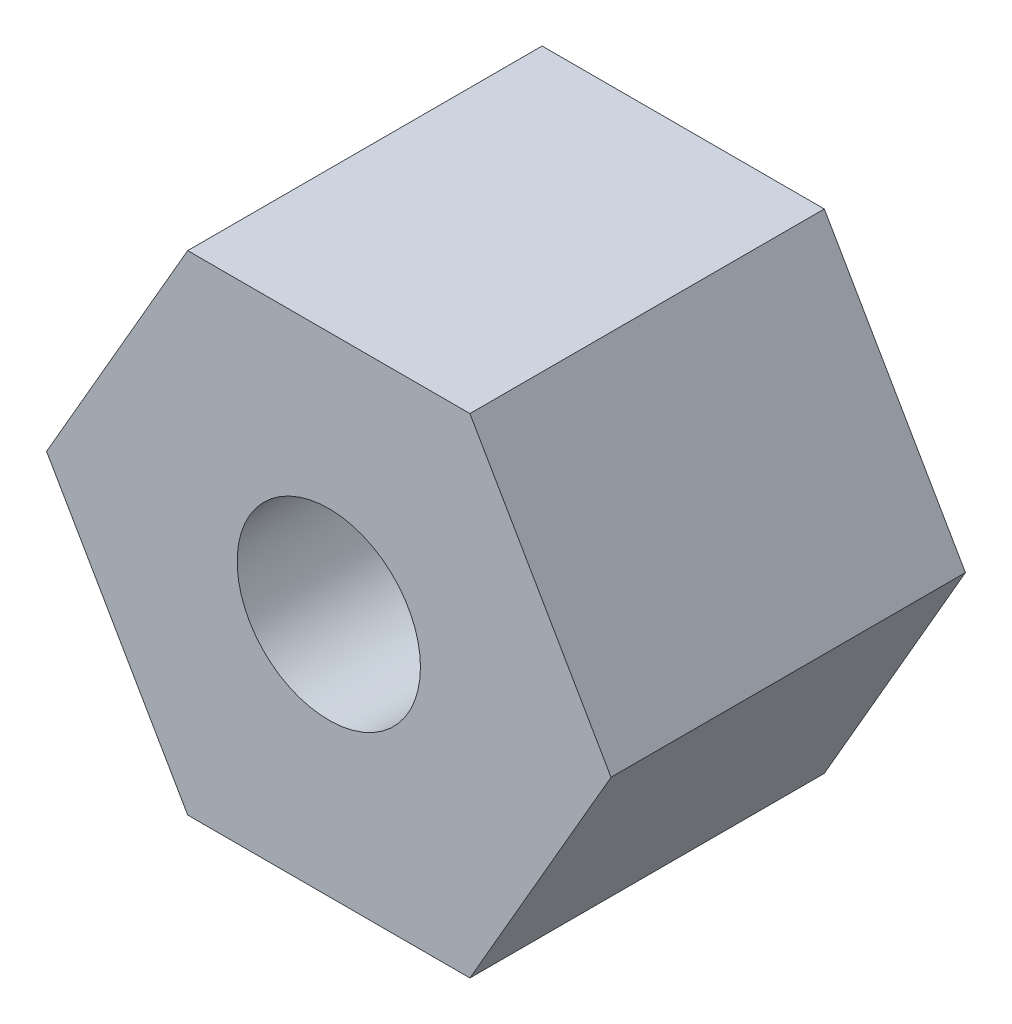
from build123d import *

# Parameters (mm, degrees)
SKETCH_1_R      = 1.5
EXTRUDE_1_DEPTH = 5.8


with BuildPart() as part:
    # 草图1 → 凸台-拉伸1 (new body)
    with BuildSketch(Plane.XY):
        Polygon((2.309401077, -4), (4.618802154, 0), (2.309401077, 4), (-2.309401077, 4), (-4.618802154, 0), (-2.309401077, -4), align=None)
        Circle(SKETCH_1_R, mode=Mode.SUBTRACT)
    extrude(amount=EXTRUDE_1_DEPTH)


solid = part.part
